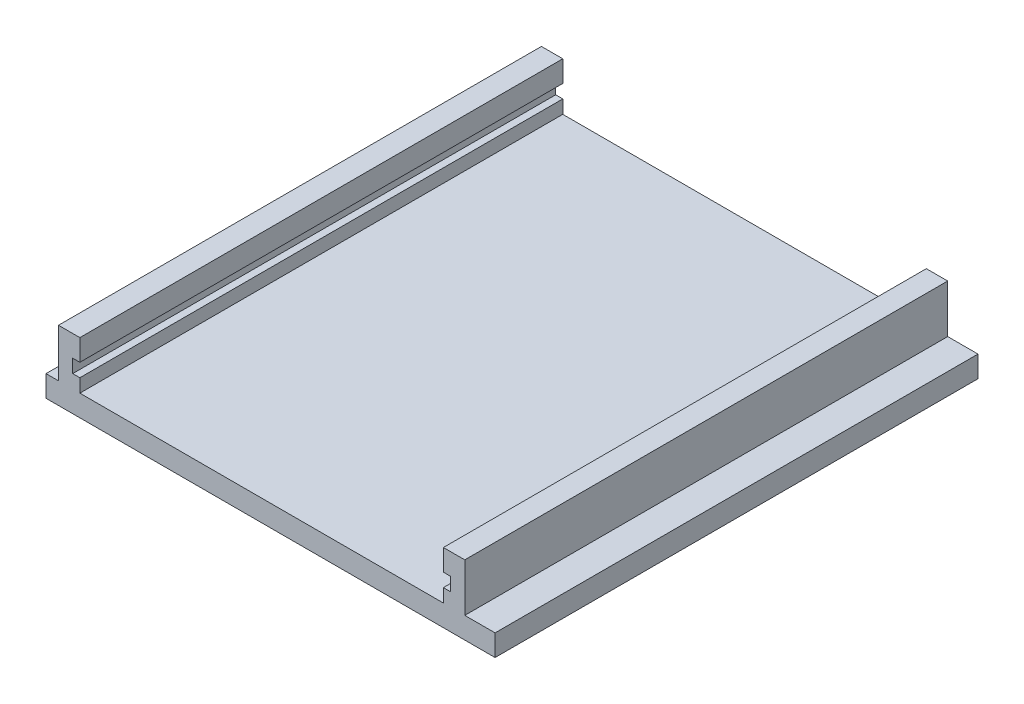
from build123d import *

# Parameters (mm, degrees)
SKETCH1_W           = 64.008
SKETCH1_H           = 68.834
BOSS_EXTRUDE1_DEPTH = 3.048
SKETCH2_W           = 3.048
SKETCH2_H           = 68.834
BOSS_EXTRUDE2_DEPTH = 6.858
SKETCH3_W           = 1.016
SKETCH3_H           = 1.905
CUT_EXTRUDE1_DEPTH  = 95.515990478
SKETCH4_W           = 3.048
SKETCH4_H           = 68.834
BOSS_EXTRUDE3_DEPTH = 6.858
SKETCH5_W           = 1.016
SKETCH5_H           = 1.905
CUT_EXTRUDE2_DEPTH  = 95.515990478


with BuildPart() as part:
    # Sketch1 → Boss-Extrude1 (new body)
    with BuildSketch(Plane(origin=(0, 0, 0), x_dir=(1, 0, 0), z_dir=(0, 1, 0))):
        with Locations((32.004, 34.417)):
            Rectangle(SKETCH1_W, SKETCH1_H)
    extrude(amount=BOSS_EXTRUDE1_DEPTH)

    # Sketch2 → Boss-Extrude2 (add)
    with BuildSketch(Plane(origin=(0, 3.048, 0), x_dir=(1, 0, 0), z_dir=(0, 1, 0))):
        with Locations((58.166, 34.417)):
            Rectangle(SKETCH2_W, SKETCH2_H)
    extrude(amount=BOSS_EXTRUDE2_DEPTH)

    # Sketch3 → Cut-Extrude1 (cut, through all)
    with BuildSketch(Plane.XY):
        with Locations((57.15, 5.9055)):
            Rectangle(SKETCH3_W, SKETCH3_H)
    extrude(amount=-CUT_EXTRUDE1_DEPTH, mode=Mode.SUBTRACT)

    # Sketch4 → Boss-Extrude3 (add)
    with BuildSketch(Plane(origin=(0, 3.048, 0), x_dir=(1, 0, 0), z_dir=(0, 1, 0))):
        with Locations((3.302, 34.417)):
            Rectangle(SKETCH4_W, SKETCH4_H)
    extrude(amount=BOSS_EXTRUDE3_DEPTH)

    # Sketch5 → Cut-Extrude2 (cut, through all)
    with BuildSketch(Plane.XY):
        with Locations((4.318, 5.9055)):
            Rectangle(SKETCH5_W, SKETCH5_H)
    extrude(amount=-CUT_EXTRUDE2_DEPTH, mode=Mode.SUBTRACT)


solid = part.part
